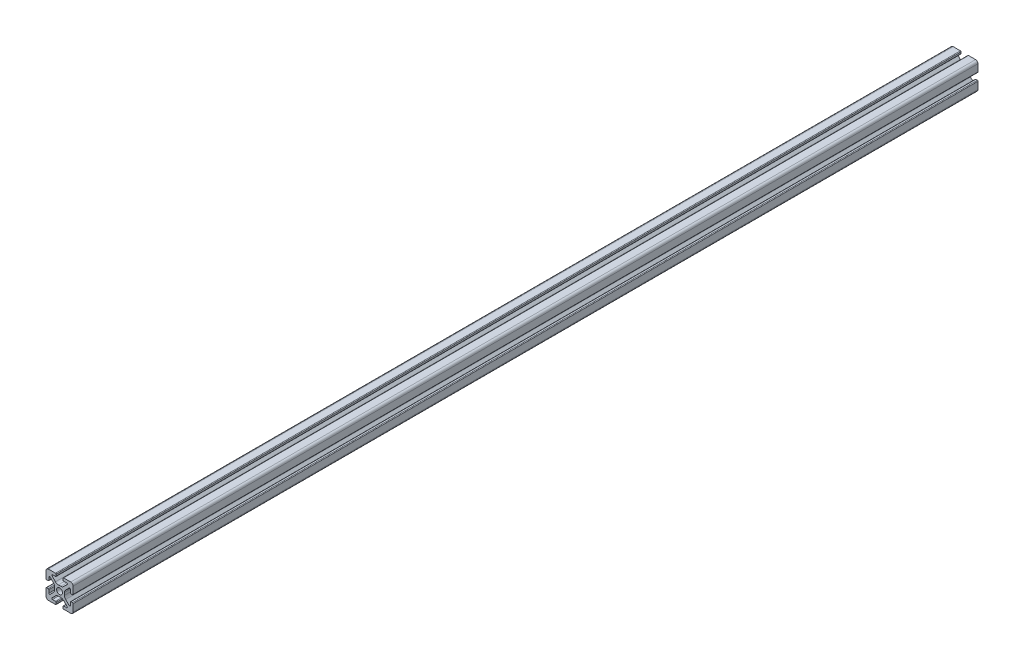
from build123d import *

# Parameters (mm, degrees)
BOSS_EXTRUDE1_DEPTH = 250
SCALE1_SCALE_X      = 0.75
SCALE1_SCALE_Y      = 0.75
SCALE1_SCALE_Z      = 1


with BuildPart() as part:
    # Sketch4 → Boss-Extrude1 (new, symmetric)
    with BuildSketch(Plane.XY):
        with BuildLine():
            Line((3, -10), (8.25, -10))
            ThreePointArc((8.25, -10), (9.487436867, -9.487436867), (10, -8.25))
            Line((10, -8.25), (10, -3))
            ThreePointArc((10, -3), (9.853553391, -2.646446609), (9.5, -2.5))
            Line((9.5, -2.5), (8.424621202, -2.5))
            ThreePointArc((8.424621202, -2.5), (8.071067812, -2.646446609), (7.924621202, -3))
            Line((7.924621202, -3), (7.924621202, -5.25))
            ThreePointArc((7.924621202, -5.25), (7.615962919, -5.711939766), (7.071067812, -5.603553391))
            Line((7.071067812, -5.603553391), (4.478679656, -3.011165235))
            ThreePointArc((4.478679656, -3.011165235), (3.828361402, -2.037895189), (3.6, -0.889844892))
            Line((3.6, -0.889844892), (3.6, 0))
            Line((3.6, 0), (2.15, 0))
            ThreePointArc((2.15, 0), (1.52027958, -1.52027958), (0, -2.15))
            Line((0, -2.15), (0, -3.6))
            Line((0, -3.6), (0.889844892, -3.6))
            ThreePointArc((0.889844892, -3.6), (2.037895189, -3.828361402), (3.011165235, -4.478679656))
            Line((3.011165235, -4.478679656), (5.603553391, -7.071067812))
            ThreePointArc((5.603553391, -7.071067812), (5.711939766, -7.615962919), (5.25, -7.924621202))
            Line((5.25, -7.924621202), (3, -7.924621202))
            ThreePointArc((3, -7.924621202), (2.646446609, -8.071067812), (2.5, -8.424621202))
            Line((2.5, -8.424621202), (2.5, -9.5))
            ThreePointArc((2.5, -9.5), (2.646446609, -9.853553391), (3, -10))
        make_face()
    extrude(amount=BOSS_EXTRUDE1_DEPTH, both=True)

    # Mirror1: part across plane


with BuildPart() as part_1:
    add(part.part)
    add(part.part.mirror(Plane(origin=(0, 0, 0), x_dir=(0, 0, 1), z_dir=(1, 0, 0))))

    # Mirror2: part across plane


with BuildPart() as part_2:
    add(part_1.part)
    add(part_1.part.mirror(Plane.ZX))


with BuildPart() as part_3:
    # Scale1: scaled about (0, 0, 0)
    add(part_2.part.scale((SCALE1_SCALE_X, SCALE1_SCALE_Y, SCALE1_SCALE_Z), about=(0, 0, 0)))


solid = part_3.part
